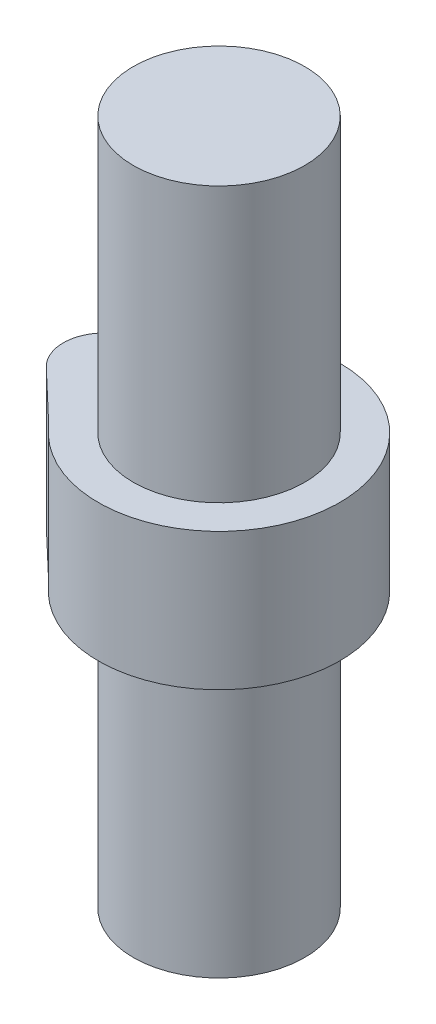
from build123d import *

# Parameters (mm, degrees)
SCHIZZO1_R                   = 6.25
ESTRUSIONE_ESTRUSIONE1_DEPTH = 20
ESTRUSIONE_ESTRUSIONE2_DEPTH = 10
RACCORDO1_R                  = 3
SCHIZZO3_R                   = 6.25
ESTRUSIONE_ESTRUSIONE3_DEPTH = 20


with BuildPart() as part:
    # Schizzo1 → Estrusione-Estrusione1 (new body)
    with BuildSketch(Plane(origin=(0, 0, 0), x_dir=(1, 0, 0), z_dir=(0, 1, 0))):
        with Locations(Location((0, 0, 0), (0, 0, 270))):
            Circle(SCHIZZO1_R)
    extrude(amount=ESTRUSIONE_ESTRUSIONE1_DEPTH)

    # Schizzo2 → Estrusione-Estrusione2 (add)
    with BuildSketch(Plane(origin=(0, 20, 0), x_dir=(1, 0, 0), z_dir=(0, 1, 0))):
        with BuildLine():
            Line((-6.25, 6.194957627), (-12.7, 0))
            Line((-12.7, 0), (-6.657351546, -5.754969192))
            ThreePointArc((-6.657351546, -5.754969192), (8.794891627, -0.299802062), (-6.25, 6.194957627))
        make_face()
    extrude(amount=ESTRUSIONE_ESTRUSIONE2_DEPTH)

    # Raccordo1
    raccordo1_edges = [part.edges().sort_by_distance(p)[0] for p in [
        (-12.7, 25, 0),
    ]]
    fillet(raccordo1_edges, radius=RACCORDO1_R)

    # Schizzo3 → Estrusione-Estrusione3 (add)
    with BuildSketch(Plane(origin=(0, 30, 0), x_dir=(1, 0, 0), z_dir=(0, 1, 0))):
        with Locations(Location((0, 0, 0), (0, 0, 270))):
            Circle(SCHIZZO3_R)
    extrude(amount=ESTRUSIONE_ESTRUSIONE3_DEPTH)


solid = part.part
